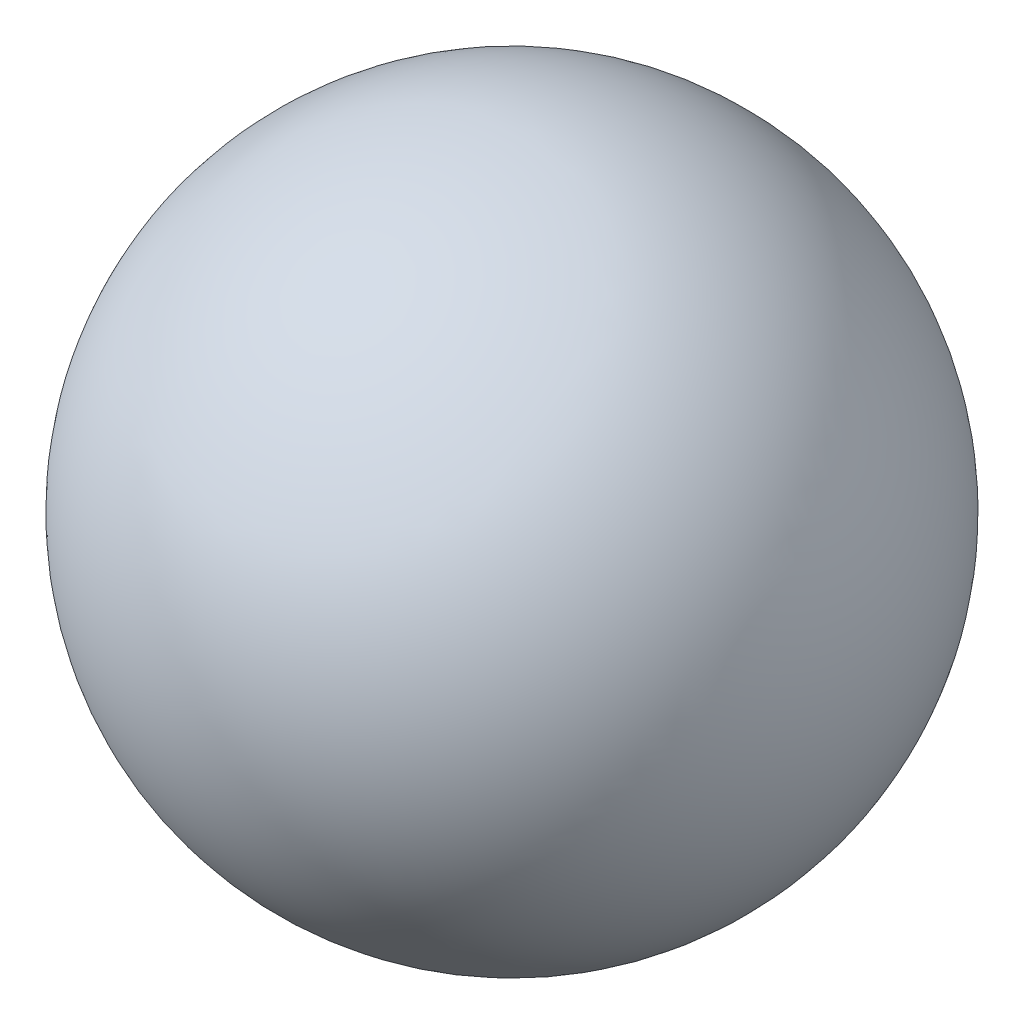
from build123d import *


with BuildPart() as part:
    # Sketch1 → Revolve1 (revolve)
    with BuildSketch(Plane.XY):
        with BuildLine():
            Line((-30, 0), (30, 0))
            ThreePointArc((30, 0), (0, -30), (-30, 0))
        make_face()
    revolve(axis=Axis((-30, 0, 0), (1, 0, 0)))


solid = part.part
